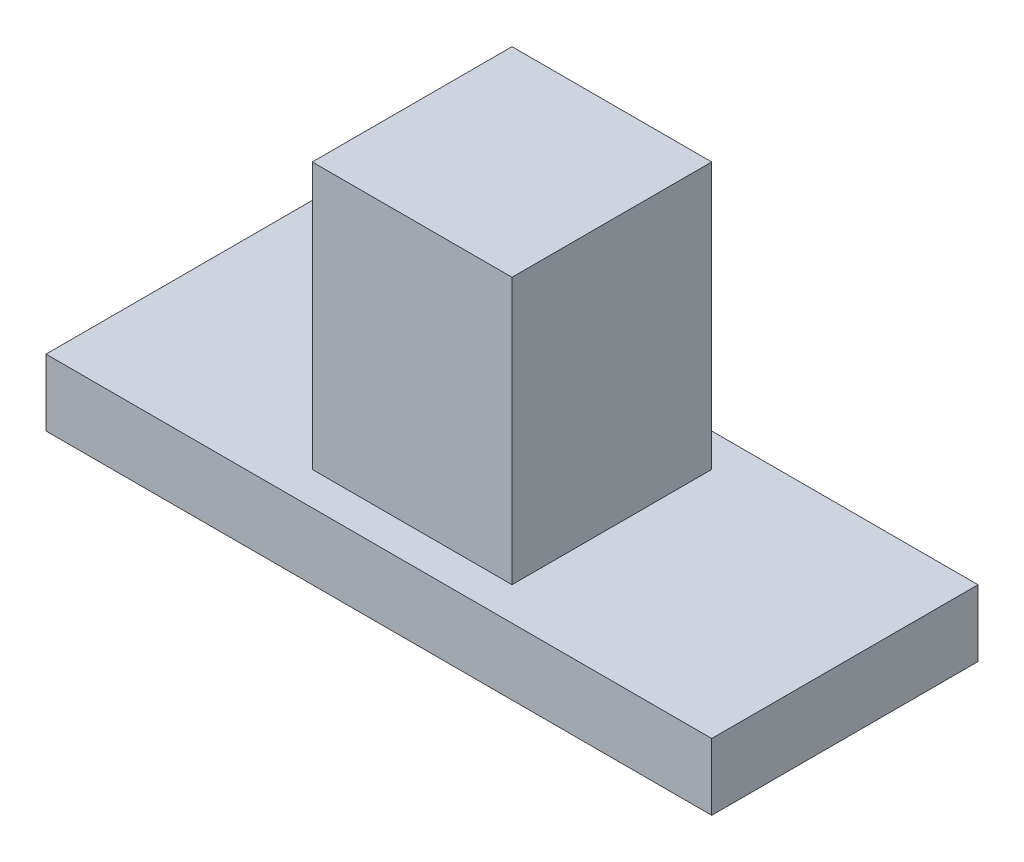
from build123d import *

# Parameters (mm, degrees)
SKETCH_1_W          = 10
SKETCH_1_H          = 5
EXTRUDE_1_DEPTH     = 0.5
SKETCH_2_W          = 3
SKETCH_2_H          = 3
EXTRUDE_2_DEPTH     = 0.5
SKETCH_3_W          = 10
SKETCH_3_H          = 5
EXTRUDE_3_DEPTH     = 0.5
EXTRUDE_4_DEPTH     = 5
CUT_EXTRUDE_3_DEPTH = 5
SKETCH_6_W          = 1.6
SKETCH_6_H          = 1.6
CUT_EXTRUDE_4_DEPTH = 1.5
SKETCH_7_W          = 10
SKETCH_7_H          = 0.5
CUT_EXTRUDE_5_DEPTH = 1
SKETCH_8_W          = 10
SKETCH_8_H          = 4
EXTRUDE_5_DEPTH     = 1
SKETCH_11_W         = 10
SKETCH_11_H         = 4
SKETCH_11_W_2       = 3
SKETCH_11_H_2       = 3
CUT_EXTRUDE_6_DEPTH = 0.5
CUT_EXTRUDE_7_REACH = 8.124
SKETCH_6_2_W        = 1.6
SKETCH_6_2_H        = 1.6
SKETCH_12_W         = 10
SKETCH_12_H         = 5
CUT_EXTRUDE_8_DEPTH = 6.937171044
SKETCH_13_W         = 3
SKETCH_13_H         = 3
EXTRUDE_6_DEPTH     = 3
SKETCH_14_W         = 1.7
SKETCH_14_H         = 1.7
CUT_EXTRUDE_9_DEPTH = 4


with BuildPart() as part:
    # 草图1 → 凸台-拉伸1 (new body)
    with BuildSketch(Plane(origin=(0, 0, 0), x_dir=(1, 0, 0), z_dir=(0, 1, 0))):
        Rectangle(SKETCH_1_W, SKETCH_1_H)
    extrude(amount=EXTRUDE_1_DEPTH)

    # 草图2 → 凸台-拉伸2 (add)
    with BuildSketch(Plane(origin=(0, 0.5, 0), x_dir=(1, 0, 0), z_dir=(0, 1, 0))):
        Rectangle(SKETCH_2_W, SKETCH_2_H)
    extrude(amount=EXTRUDE_2_DEPTH)

    # 草图3 → 凸台-拉伸3 (add)
    with BuildSketch(Plane(origin=(0, 1, 0), x_dir=(1, 0, 0), z_dir=(0, 1, 0))):
        Rectangle(SKETCH_3_W, SKETCH_3_H)
    extrude(amount=EXTRUDE_3_DEPTH)

    # 草图4 → 凸台-拉伸4 (add)
    with BuildSketch(Plane.XY.offset(2.5)):
        with BuildLine():
            Line((-5, 1.5), (5, 1.5))
            ThreePointArc((5, 1.5), (0, 2.5), (-5, 1.5))
        make_face()
    extrude(amount=-EXTRUDE_4_DEPTH)

    # 草图5 → 切除-拉伸3 (cut)
    with BuildSketch(Plane.XY.offset(2.5)):
        with BuildLine():
            Line((-4.75, 2.75), (-4.25, 2.75))
            Line((-4.25, 2.75), (-4.25, 1.535662375))
            ThreePointArc((-4.25, 1.535662375), (-4.50094573, 1.445961936), (-4.75, 1.35113631))
            Line((-4.75, 1.35113631), (-4.75, 2.75))
        make_face()
        with BuildLine():
            Line((-3.75, 2.75), (-3.75, 1.697389285))
            ThreePointArc((-3.75, 1.697389285), (-3.500697998, 1.769788877), (-3.25, 1.837195875))
            Line((-3.25, 1.837195875), (-3.25, 2.75))
            Line((-3.25, 2.75), (-3.75, 2.75))
        make_face()
        with BuildLine():
            Line((-2.75, 2.75), (-2.75, 1.95580576))
            ThreePointArc((-2.75, 1.95580576), (-2.500480176, 2.007256715), (-2.25, 2.053808027))
            Line((-2.25, 2.053808027), (-2.25, 2.75))
            Line((-2.25, 2.75), (-2.75, 2.75))
        make_face()
        with BuildLine():
            Line((-1.75, 2.75), (-1.75, 2.131673028))
            ThreePointArc((-1.75, 2.131673028), (-1.50028119, 2.163138904), (-1.25, 2.189764295))
            Line((-1.25, 2.189764295), (-1.25, 2.75))
            Line((-1.25, 2.75), (-1.75, 2.75))
        make_face()
        with BuildLine():
            Line((-0.75, 2.75), (-0.75, 2.228347352))
            ThreePointArc((-0.75, 2.228347352), (-0.500092618, 2.240377492), (-0.25, 2.247595932))
            Line((-0.25, 2.247595932), (-0.25, 2.75))
            Line((-0.25, 2.75), (-0.75, 2.75))
        make_face()
        with BuildLine():
            Line((0.25, 2.75), (0.25, 2.247595932))
            ThreePointArc((0.25, 2.247595932), (0.500092618, 2.240377492), (0.75, 2.228347352))
            Line((0.75, 2.228347352), (0.75, 2.75))
            Line((0.75, 2.75), (0.25, 2.75))
        make_face()
        with BuildLine():
            Line((1.25, 2.75), (1.25, 2.189764295))
            ThreePointArc((1.25, 2.189764295), (1.50028119, 2.163138904), (1.75, 2.131673028))
            Line((1.75, 2.131673028), (1.75, 2.75))
            Line((1.75, 2.75), (1.25, 2.75))
        make_face()
        with BuildLine():
            Line((2.25, 2.75), (2.25, 2.053808027))
            ThreePointArc((2.25, 2.053808027), (2.500480176, 2.007256715), (2.75, 1.95580576))
            Line((2.75, 1.95580576), (2.75, 2.75))
            Line((2.75, 2.75), (2.25, 2.75))
        make_face()
        with BuildLine():
            Line((3.25, 2.75), (3.25, 1.837195875))
            ThreePointArc((3.25, 1.837195875), (3.500697998, 1.769788877), (3.75, 1.697389285))
            Line((3.75, 1.697389285), (3.75, 2.75))
            Line((3.75, 2.75), (3.25, 2.75))
        make_face()
        with BuildLine():
            Line((4.25, 2.75), (4.25, 1.535662375))
            ThreePointArc((4.25, 1.535662375), (4.50094573, 1.445961936), (4.75, 1.35113631))
            Line((4.75, 1.35113631), (4.75, 2.75))
            Line((4.75, 2.75), (4.25, 2.75))
        make_face()
    extrude(amount=-CUT_EXTRUDE_3_DEPTH, mode=Mode.SUBTRACT)

    # 草图6 → 切除-拉伸4 (cut)
    with BuildSketch(Plane.XZ):
        Rectangle(SKETCH_6_W, SKETCH_6_H)
    extrude(amount=-CUT_EXTRUDE_4_DEPTH, mode=Mode.SUBTRACT)

    # 草图7 → 切除-拉伸5 (cut)
    with BuildSketch(Plane.XZ):
        with Locations((0, 2.25)):
            Rectangle(SKETCH_7_W, SKETCH_7_H)
        with Locations((0, -2.25)):
            Rectangle(SKETCH_7_W, SKETCH_7_H)
    extrude(amount=-CUT_EXTRUDE_5_DEPTH, mode=Mode.SUBTRACT)

    # 草图8 → 凸台-拉伸5 (add)
    with BuildSketch(Plane.XZ):
        Rectangle(SKETCH_8_W, SKETCH_8_H)
    extrude(amount=EXTRUDE_5_DEPTH)

    # 草图11 → 切除-拉伸6 (cut)
    with BuildSketch(Plane(origin=(0, 0.5, 0), x_dir=(1, 0, 0), z_dir=(0, 1, 0))):
        Rectangle(SKETCH_11_W, SKETCH_11_H)
        Rectangle(SKETCH_11_W_2, SKETCH_11_H_2, mode=Mode.SUBTRACT)
    extrude(amount=-CUT_EXTRUDE_6_DEPTH, mode=Mode.SUBTRACT)

    # 草图6<2> → 切除-拉伸7 (cut, up to next)
    with BuildSketch(Plane.XZ, mode=Mode.PRIVATE) as cut_extrude_7_sk1:
        Rectangle(SKETCH_6_2_W, SKETCH_6_2_H)
    cut_extrude_7_tool1 = extrude(cut_extrude_7_sk1.sketch, amount=CUT_EXTRUDE_7_REACH, mode=Mode.PRIVATE) & part.part
    add(cut_extrude_7_tool1.solids().sort_by_distance((0, 0, 0))[0], mode=Mode.SUBTRACT)

    # 草图12 → 切除-拉伸8 (cut, through all)
    with BuildSketch(Plane.XZ.offset(-1)):
        Rectangle(SKETCH_12_W, SKETCH_12_H)
    extrude(amount=-CUT_EXTRUDE_8_DEPTH, mode=Mode.SUBTRACT)

    # 草图13 → 凸台-拉伸6 (add)
    with BuildSketch(Plane(origin=(0, 1, 0), x_dir=(1, 0, 0), z_dir=(0, 1, 0))):
        Rectangle(SKETCH_13_W, SKETCH_13_H)
    extrude(amount=EXTRUDE_6_DEPTH)

    # 草图14 → 切除-拉伸9 (cut)
    with BuildSketch(Plane.XZ.offset(1)):
        Rectangle(SKETCH_14_W, SKETCH_14_H)
    extrude(amount=-CUT_EXTRUDE_9_DEPTH, mode=Mode.SUBTRACT)


solid = part.part
